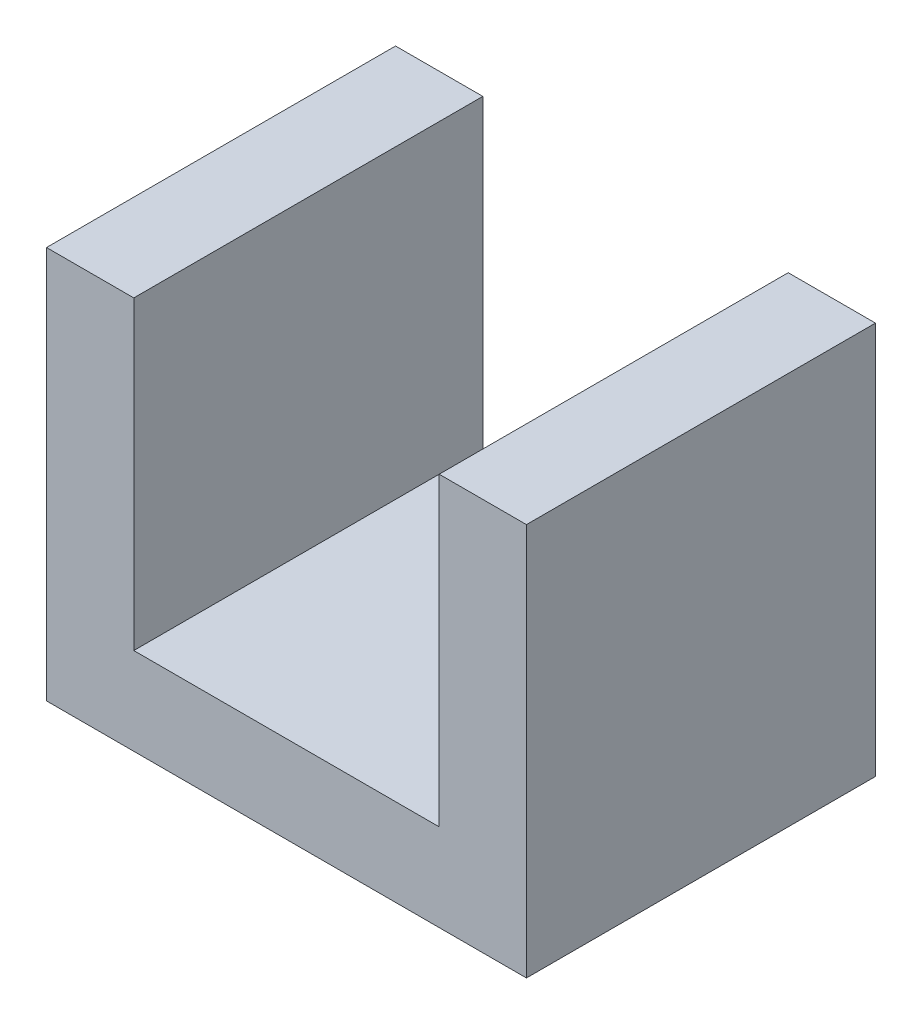
from build123d import *

# Parameters (mm, degrees)
BOSS_EXTRUDE1_DEPTH = 8


with BuildPart() as part:
    # Sketch1 → Boss-Extrude1 (new body)
    with BuildSketch(Plane.XY):
        Polygon((0, 7), (0, 0), (7, 0), (7, 7), (9, 7), (9, -2), (-2, -2), (-2, 7), align=None)
    extrude(amount=BOSS_EXTRUDE1_DEPTH)


solid = part.part
